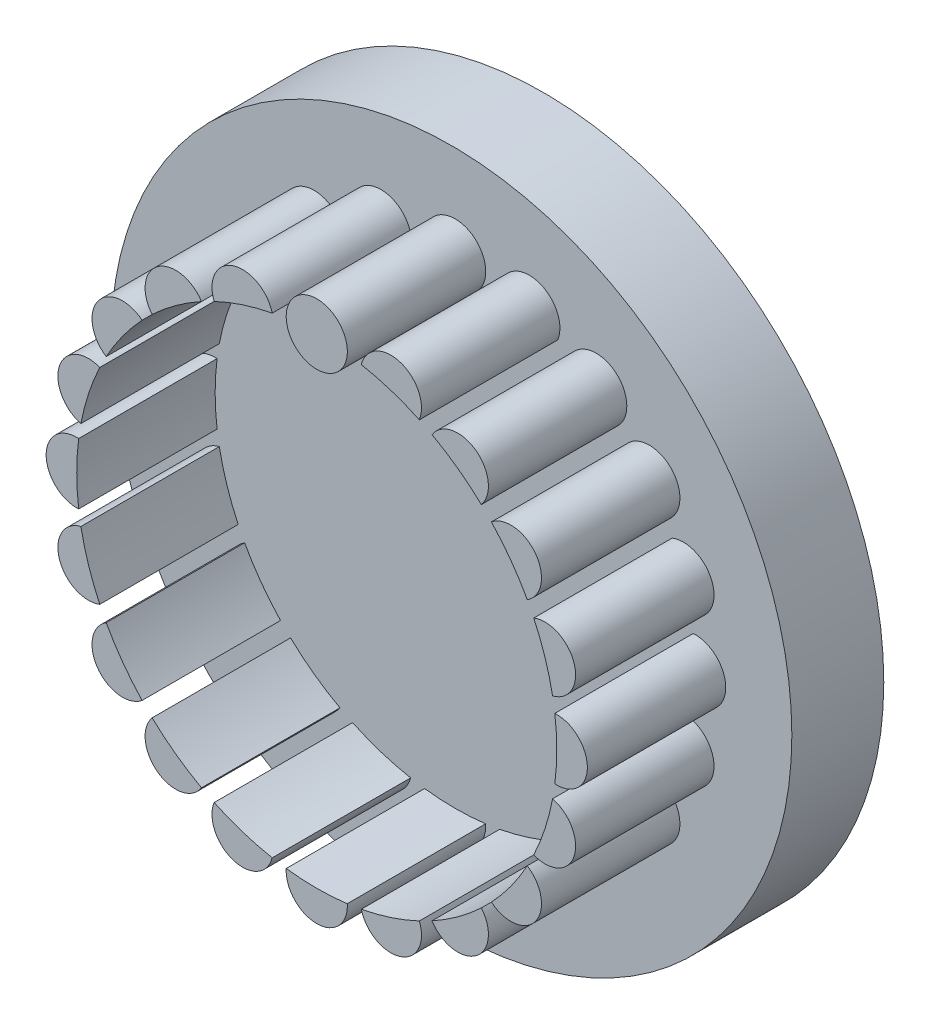
from build123d import *

# Parameters (mm, degrees)
EXTRUDE_1_DEPTH      = 3.710930537
EXTRUDE_1_DEPTH_BACK = 3.473333137
SKETCH_1_R           = 26.605035468
SKETCH_4_W           = 6.02260113
SKETCH_4_H           = 5.98653765
EXTRUDE_2_DEPTH      = 18


with BuildPart() as part:
    # 草图1 → 凸台-拉伸1 (new, two sides: drawn at the far end of the back side and taken through both)
    with BuildSketch(Plane(origin=(4.976775399, -23.162053726, 0), x_dir=(1, 0, 0), z_dir=(0, 0, 1)).offset(-EXTRUDE_1_DEPTH_BACK)):
        with Locations((-5.271905078, 22.51796653)):
            Circle(SKETCH_1_R)
    extrude(amount=EXTRUDE_1_DEPTH + EXTRUDE_1_DEPTH_BACK)

    # 草图4 → 切除-旋转1 (revolve, cut)
    with BuildSketch(Plane(origin=(0, 0, -0.114580032), x_dir=(1, 0, 0), z_dir=(0, 1, 0))):
        with Locations((-18.633409167, 0.825025845)):
            Rectangle(SKETCH_4_W, SKETCH_4_H)
    revolve(axis=Axis((0, 0, -21.724133591), (0, 0, 1)), mode=Mode.SUBTRACT)

    # 草图6 → 凸台-拉伸2 (add)
    with BuildSketch(Plane(origin=(0, 0, -3.473333137), x_dir=(-1, 0, 0), z_dir=(0, 0, -1))):
        with BuildLine():
            ThreePointArc((2.38482577, 18.602889633), (0, 21.144809988), (-2.38482577, 18.602889633))
            ThreePointArc((-2.38482577, 18.602889633), (0, 16.365449762), (2.38482577, 18.602889633))
        make_face()
        with BuildLine():
            ThreePointArc((-8.016713129, 16.955447716), (-5.795653863, 17.837188482), (-3.480504953, 18.429351099))
            ThreePointArc((-3.480504953, 18.429351099), (-6.534105629, 20.109909325), (-8.016713129, 16.955447716))
        make_face()
        with BuildLine():
            ThreePointArc((8.016713129, 16.955447716), (6.534105629, 20.109909325), (3.480504953, 18.429351099))
            ThreePointArc((3.480504953, 18.429351099), (5.795653863, 17.837188482), (8.016713129, 16.955447716))
        make_face()
        with BuildLine():
            ThreePointArc((-12.863868752, 13.648288441), (-11.023988745, 15.173218801), (-9.0051396, 16.451819274))
            ThreePointArc((-9.0051396, 16.451819274), (-12.428607474, 17.106510623), (-12.863868752, 13.648288441))
        make_face()
        with BuildLine():
            ThreePointArc((12.863868752, 13.648288441), (12.428607474, 17.106510623), (9.0051396, 16.451819274))
            ThreePointArc((9.0051396, 16.451819274), (11.023988745, 15.173218801), (12.863868752, 13.648288441))
        make_face()
        with BuildLine():
            ThreePointArc((-16.451819274, 9.0051396), (-15.173218801, 11.023988745), (-13.648288441, 12.863868752))
            ThreePointArc((-13.648288441, 12.863868752), (-17.106510623, 12.428607474), (-16.451819274, 9.0051396))
        make_face()
        with BuildLine():
            ThreePointArc((16.451819274, 9.0051396), (17.106510623, 12.428607474), (13.648288441, 12.863868752))
            ThreePointArc((13.648288441, 12.863868752), (15.173218801, 11.023988745), (16.451819274, 9.0051396))
        make_face()
        with BuildLine():
            ThreePointArc((-18.429351099, 3.480504953), (-17.837188482, 5.795653863), (-16.955447716, 8.016713129))
            ThreePointArc((-16.955447716, 8.016713129), (-20.109909325, 6.534105629), (-18.429351099, 3.480504953))
        make_face()
        with BuildLine():
            ThreePointArc((18.429351099, 3.480504953), (20.109909325, 6.534105629), (16.955447716, 8.016713129))
            ThreePointArc((16.955447716, 8.016713129), (17.837188482, 5.795653863), (18.429351099, 3.480504953))
        make_face()
        with BuildLine():
            ThreePointArc((-18.602889633, -2.38482577), (-18.755129875, 0), (-18.602889633, 2.38482577))
            ThreePointArc((-18.602889633, 2.38482577), (-21.144809988, 0), (-18.602889633, -2.38482577))
        make_face()
        with BuildLine():
            ThreePointArc((18.602889633, -2.38482577), (21.144809988, 0), (18.602889633, 2.38482577))
            ThreePointArc((18.602889633, 2.38482577), (18.755129875, 0), (18.602889633, -2.38482577))
        make_face()
        with BuildLine():
            ThreePointArc((-16.955447716, -8.016713129), (-17.837188482, -5.795653863), (-18.429351099, -3.480504953))
            ThreePointArc((-18.429351099, -3.480504953), (-20.109909325, -6.534105629), (-16.955447716, -8.016713129))
        make_face()
        with BuildLine():
            ThreePointArc((16.955447716, -8.016713129), (20.109909325, -6.534105629), (18.429351099, -3.480504953))
            ThreePointArc((18.429351099, -3.480504953), (17.837188482, -5.795653863), (16.955447716, -8.016713129))
        make_face()
        with BuildLine():
            ThreePointArc((-13.648288441, -12.863868752), (-15.173218801, -11.023988745), (-16.451819274, -9.0051396))
            ThreePointArc((-16.451819274, -9.0051396), (-17.106510623, -12.428607474), (-13.648288441, -12.863868752))
        make_face()
        with BuildLine():
            ThreePointArc((13.648288441, -12.863868752), (17.106510623, -12.428607474), (16.451819274, -9.0051396))
            ThreePointArc((16.451819274, -9.0051396), (15.173218801, -11.023988745), (13.648288441, -12.863868752))
        make_face()
        with BuildLine():
            ThreePointArc((-9.0051396, -16.451819274), (-11.023988745, -15.173218801), (-12.863868752, -13.648288441))
            ThreePointArc((-12.863868752, -13.648288441), (-12.428607474, -17.106510623), (-9.0051396, -16.451819274))
        make_face()
        with BuildLine():
            ThreePointArc((9.0051396, -16.451819274), (12.428607474, -17.106510623), (12.863868752, -13.648288441))
            ThreePointArc((12.863868752, -13.648288441), (11.023988745, -15.173218801), (9.0051396, -16.451819274))
        make_face()
        with BuildLine():
            ThreePointArc((-3.480504953, -18.429351099), (-5.795653863, -17.837188482), (-8.016713129, -16.955447716))
            ThreePointArc((-8.016713129, -16.955447716), (-6.534105629, -20.109909325), (-3.480504953, -18.429351099))
        make_face()
        with BuildLine():
            ThreePointArc((3.480504953, -18.429351099), (6.534105629, -20.109909325), (8.016713129, -16.955447716))
            ThreePointArc((8.016713129, -16.955447716), (5.795653863, -17.837188482), (3.480504953, -18.429351099))
        make_face()
        with BuildLine():
            ThreePointArc((2.38482577, -18.602889633), (0, -18.755129875), (-2.38482577, -18.602889633))
            ThreePointArc((-2.38482577, -18.602889633), (0, -21.144809988), (2.38482577, -18.602889633))
        make_face()
    extrude(amount=-EXTRUDE_2_DEPTH)


solid = part.part
